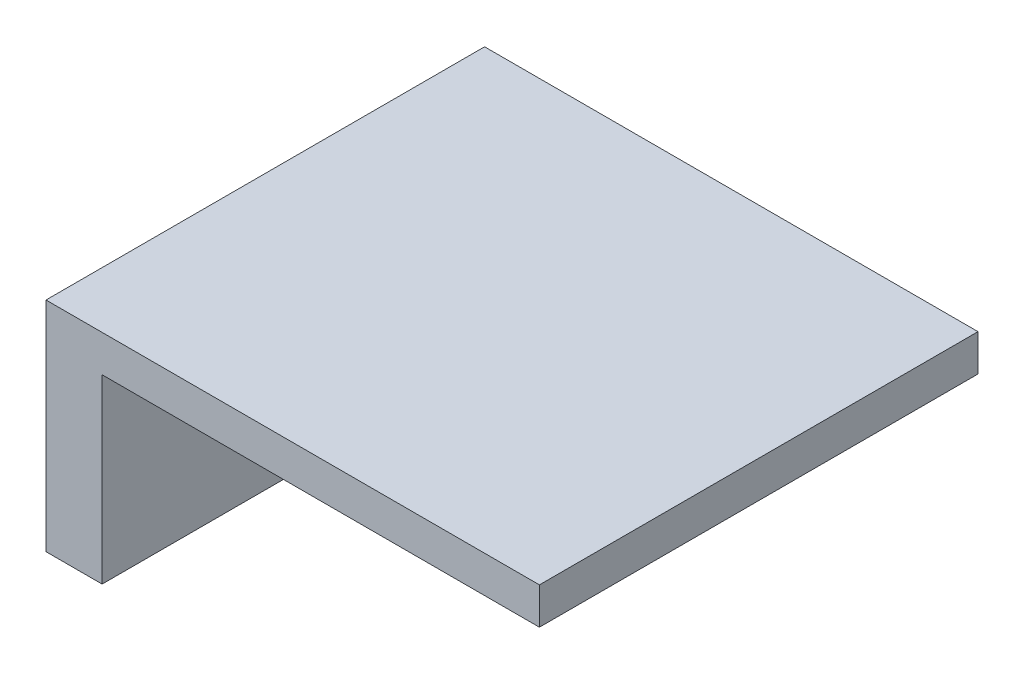
from build123d import *

# Parameters (mm, degrees)
SKETCH1_W      = 22.86
SKETCH1_H      = 20.32
EXTRUDE1_DEPTH = 1.7
SKETCH2_W      = 2.6
SKETCH2_H      = 20.32
EXTRUDE2_DEPTH = 8.4


with BuildPart() as part:
    # Sketch1 → Extrude1 (new body)
    with BuildSketch(Plane(origin=(0, 0, 0), x_dir=(1, 0, 0), z_dir=(0, 1, 0))):
        with Locations((-18.208858156, -4.831082697)):
            Rectangle(SKETCH1_W, SKETCH1_H)
    extrude(amount=EXTRUDE1_DEPTH)

    # Sketch2 → Extrude2 (add)
    with BuildSketch(Plane.XZ):
        with Locations((-28.338858156, 4.831082697)):
            Rectangle(SKETCH2_W, SKETCH2_H)
    extrude(amount=EXTRUDE2_DEPTH)


solid = part.part
